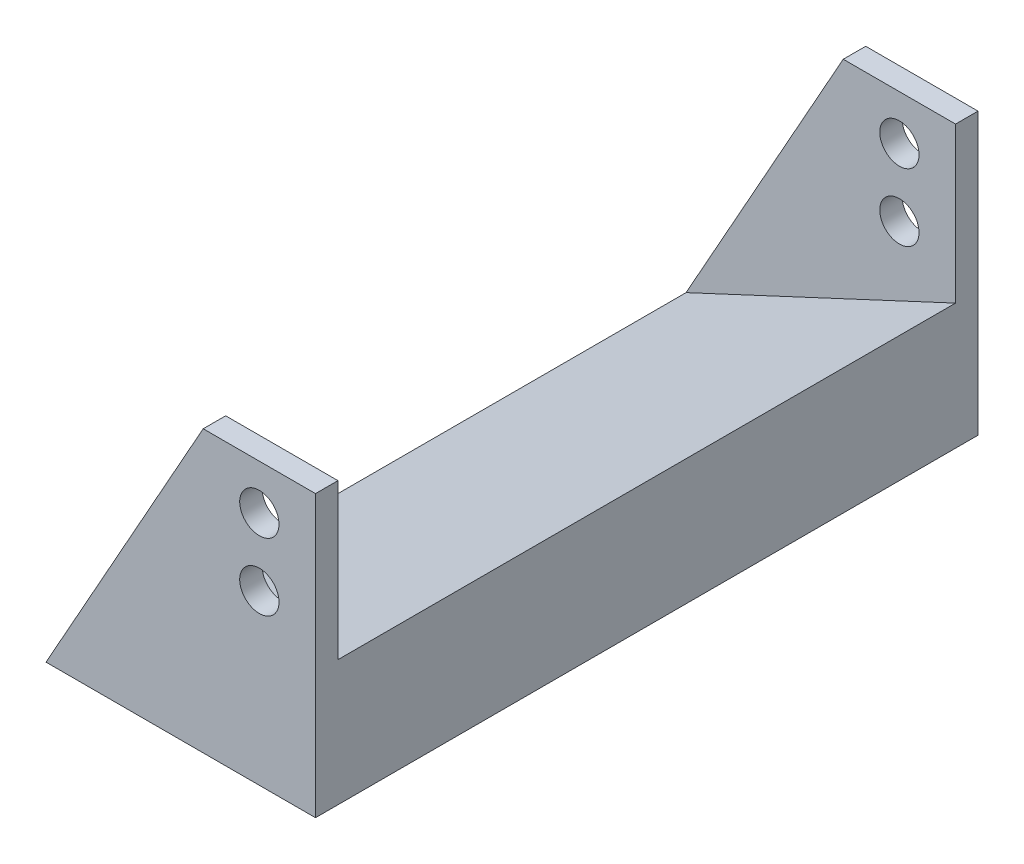
from build123d import *

# Parameters (mm, degrees)
BOSS_EXTRUDE1_DEPTH = 27.5
SKETCH2_R           = 1.75
BOSS_EXTRUDE2_DEPTH = 2


with BuildPart() as part:
    # Sketch1 → Boss-Extrude1 (new, symmetric)
    with BuildSketch(Plane.XY):
        Polygon((0, 0), (24, 0), (24, 11.191383796), align=None)
    extrude(amount=BOSS_EXTRUDE1_DEPTH, both=True)

    # Sketch2 → Boss-Extrude2 (add)
    with BuildSketch(Plane.XY.offset(27.5)):
        Polygon((24, 0), (24, 25), (14, 25), (0, 0), align=None)
        with Locations((19, 21)):
            Circle(SKETCH2_R, mode=Mode.SUBTRACT)
        with Locations((19, 15)):
            Circle(SKETCH2_R, mode=Mode.SUBTRACT)
    boss_extrude2 = extrude(amount=BOSS_EXTRUDE2_DEPTH)

    # Mirror1: Boss-Extrude2 across plane
    add(boss_extrude2.mirror(Plane.XY))


solid = part.part
